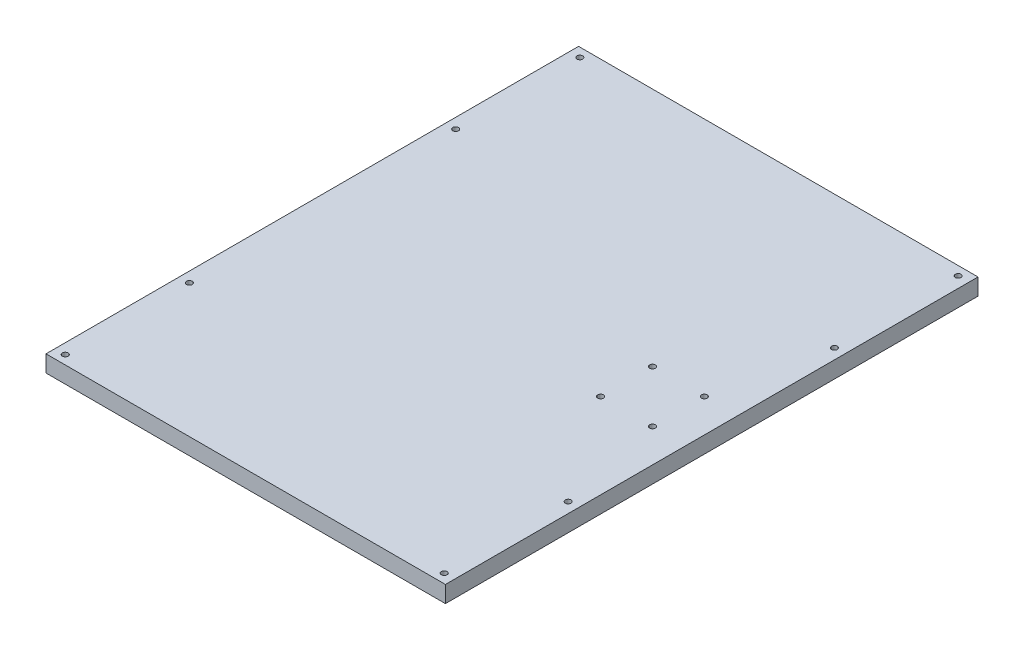
from build123d import *

# Parameters (mm, degrees)
SKETCH1_W           = 152.4
SKETCH1_H           = 203.2
SKETCH1_R           = 1.1
BOSS_EXTRUDE1_DEPTH = 6.35
SKETCH2_R           = 1.1
CUT_EXTRUDE1_DEPTH  = 6.35


with BuildPart() as part:
    # Sketch1 → Boss-Extrude1 (new body)
    with BuildSketch(Plane(origin=(0, 0, 0), x_dir=(1, 0, 0), z_dir=(0, 1, 0))):
        with Locations((76.224714482, 46.493270824)):
            Rectangle(SKETCH1_W, SKETCH1_H)
        with Locations(Location((3.936211838, 97.293270824, 0), (0, 0, 270))):
            Circle(SKETCH1_R, mode=Mode.SUBTRACT)
        with Locations(Location((3.936211838, -4.306729176, 0), (0, 0, 270))):
            Circle(SKETCH1_R, mode=Mode.SUBTRACT)
        with Locations(Location((148.463788162, -4.306729176, 0), (0, 0, 270))):
            Circle(SKETCH1_R, mode=Mode.SUBTRACT)
        with Locations(Location((148.463788162, 97.293270824, 0), (0, 0, 270))):
            Circle(SKETCH1_R, mode=Mode.SUBTRACT)
        with Locations(Location((148.291793945, 144.658604846, 0), (0, 0, 270))):
            Circle(SKETCH1_R, mode=Mode.SUBTRACT)
        with Locations(Location((148.463788162, -51.601337012, 0), (0, 0, 270))):
            Circle(SKETCH1_R, mode=Mode.SUBTRACT)
        with Locations(Location((3.936211838, -51.672063198, 0), (0, 0, 270))):
            Circle(SKETCH1_R, mode=Mode.SUBTRACT)
        with Locations(Location((3.936211838, 144.658604846, 0), (0, 0, 270))):
            Circle(SKETCH1_R, mode=Mode.SUBTRACT)
    extrude(amount=BOSS_EXTRUDE1_DEPTH)

    # Sketch2 → Cut-Extrude1 (cut)
    with BuildSketch(Plane(origin=(0, 6.35, 0), x_dir=(1, 0, 0), z_dir=(0, 1, 0))):
        with Locations(Location((119.924714482, 56.393270824, 0), (0, 0, 270))):
            Circle(SKETCH2_R)
        with Locations(Location((119.924714482, 36.593270824, 0), (0, 0, 270))):
            Circle(SKETCH2_R)
        with Locations(Location((139.724714482, 36.593270824, 0), (0, 0, 270))):
            Circle(SKETCH2_R)
        with Locations(Location((139.724714482, 56.393270824, 0), (0, 0, 270))):
            Circle(SKETCH2_R)
    extrude(amount=-CUT_EXTRUDE1_DEPTH, mode=Mode.SUBTRACT)


solid = part.part
